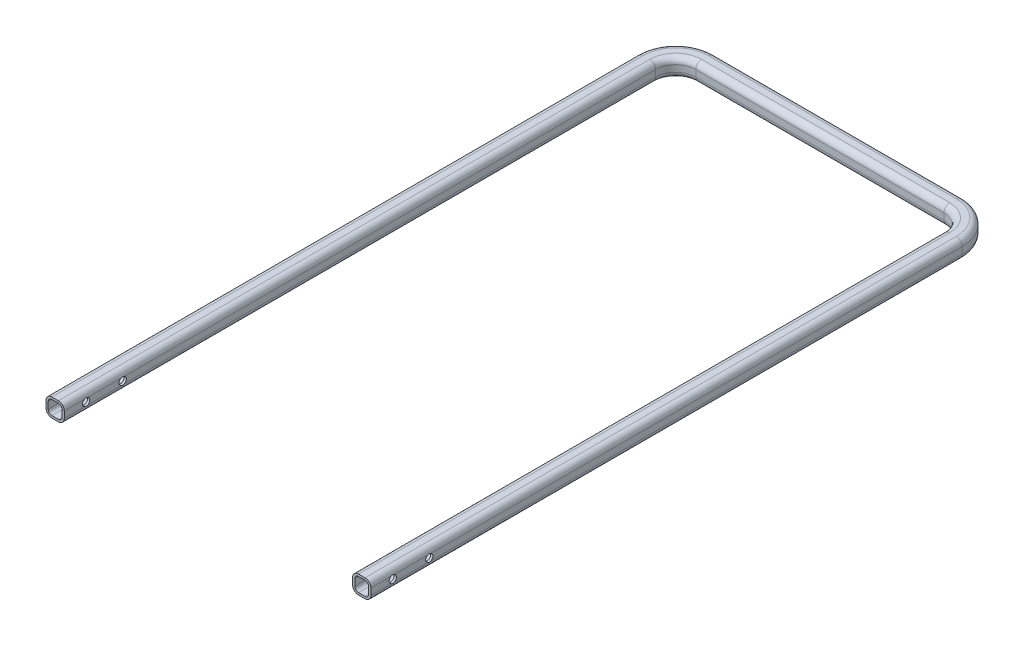
from build123d import *

# Parameters (mm, degrees)
CUT_EXTRUDE2_DEPTH      = 965.944946752
CUT_EXTRUDE2_DEPTH_BACK = 965.944946752
SKETCH4_R               = 5


with BuildPart() as part:
    # Sweep-Thin1: sweep along a path in Sketch1
    with BuildLine(Plane(origin=(0, 0, 0), x_dir=(1, 0, 0), z_dir=(0, 1, 0))) as sweep_thin1_path:
        Line((0, 0), (0, 810))
        ThreePointArc((0, 810), (11.715728753, 838.284271247), (40, 850))
        Line((40, 850), (380, 850))
        ThreePointArc((380, 850), (408.284271247, 838.284271247), (420, 810))
        Line((420, 810), (420, 0))
    # Sketch3 → Sweep-Thin1 (sweep)
    with BuildSketch(Plane.XY):
        with BuildLine():
            Line((4.5, 12.5), (-4.5, 12.5))
            ThreePointArc((-4.5, 12.5), (-10.156854249, 10.156854249), (-12.5, 4.5))
            Line((-12.5, 4.5), (-12.5, -4.5))
            ThreePointArc((-12.5, -4.5), (-10.156854249, -10.156854249), (-4.5, -12.5))
            Line((-4.5, -12.5), (4.5, -12.5))
            ThreePointArc((4.5, -12.5), (10.156854249, -10.156854249), (12.5, -4.5))
            Line((12.5, -4.5), (12.5, 4.5))
            ThreePointArc((12.5, 4.5), (10.156854249, 10.156854249), (4.5, 12.5))
        make_face()
        with BuildLine():
            Line((4.5, 9.5), (-4.5, 9.5))
            ThreePointArc((-4.5, 9.5), (-8.035533906, 8.035533906), (-9.5, 4.5))
            Line((-9.5, 4.5), (-9.5, -4.5))
            ThreePointArc((-9.5, -4.5), (-8.035533906, -8.035533906), (-4.5, -9.5))
            Line((-4.5, -9.5), (4.5, -9.5))
            ThreePointArc((4.5, -9.5), (8.035533906, -8.035533906), (9.5, -4.5))
            Line((9.5, -4.5), (9.5, 4.5))
            ThreePointArc((9.5, 4.5), (8.035533906, 8.035533906), (4.5, 9.5))
        make_face(mode=Mode.SUBTRACT)
    sweep(path=sweep_thin1_path.line)

    # Sketch4 → Cut-Extrude2 (cut, two sides: drawn at the far end of the back side and taken through both)
    with BuildSketch(Plane(origin=(0, 0, 0), x_dir=(0, 0, -1), z_dir=(1, 0, 0)).offset(-CUT_EXTRUDE2_DEPTH_BACK)):
        with Locations(Location((30, 0, 0), (0, 0, 64.158067237))):
            Circle(SKETCH4_R)
        with Locations(Location((80, 0, 0), (0, 0, 64.158067237))):
            Circle(SKETCH4_R)
    extrude(amount=CUT_EXTRUDE2_DEPTH + CUT_EXTRUDE2_DEPTH_BACK, mode=Mode.SUBTRACT)


solid = part.part
